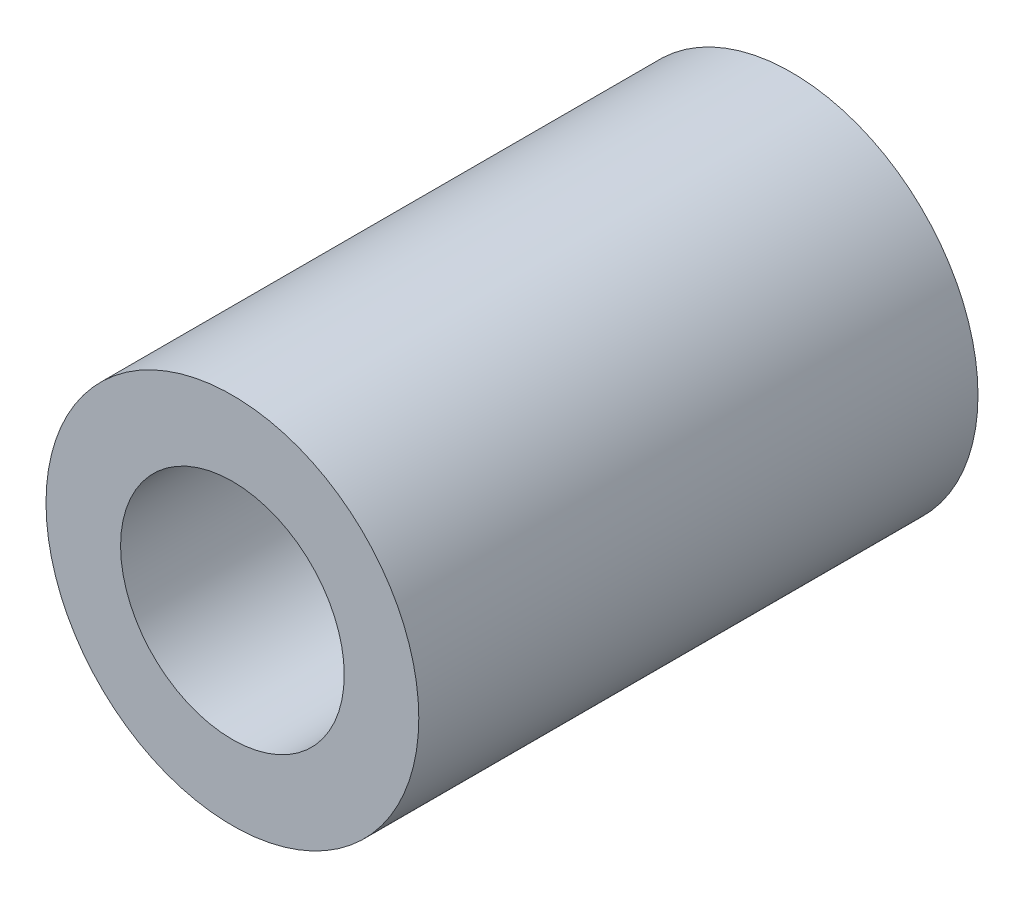
from build123d import *

# Parameters (mm, degrees)
SKETCH_1_R      = 10
SKETCH_1_R_2    = 6
EXTRUDE_1_DEPTH = 15


with BuildPart() as part:
    # 草图1 → 凸台-拉伸1 (new, symmetric)
    with BuildSketch(Plane.XY):
        Circle(SKETCH_1_R)
        Circle(SKETCH_1_R_2, mode=Mode.SUBTRACT)
    extrude(amount=EXTRUDE_1_DEPTH, both=True)


solid = part.part
